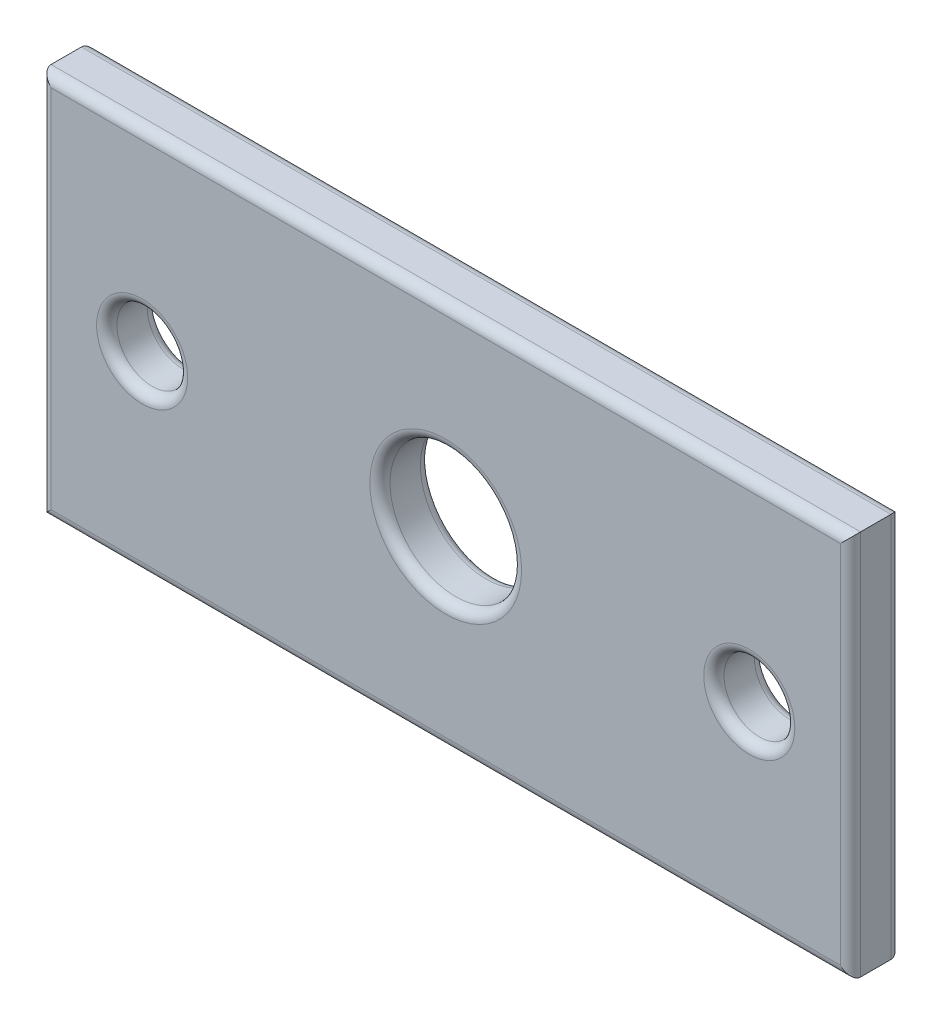
from build123d import *

# Parameters (mm, degrees)
SKETCH2_W           = 80
SKETCH2_H           = 38.1
SKETCH2_R           = 5
SKETCH2_R_2         = 10.5
SKETCH2_R_3         = 6.5
SKETCH2_R_4         = 3.5
BOSS_EXTRUDE1_DEPTH = 5
FILLET1_R           = 1


with BuildPart() as part:
    # Sketch2 → Boss-Extrude1 (new body)
    # profile 1 of 4: a face of its own
    with BuildSketch(Plane.XY):
        with Locations((40, -19.05)):
            Rectangle(SKETCH2_W, SKETCH2_H)
        with Locations((70, -19.05)):
            Circle(SKETCH2_R, mode=Mode.SUBTRACT)
        with Locations((10, -19.05)):
            Circle(SKETCH2_R, mode=Mode.SUBTRACT)
        with Locations((40, -19.05)):
            Circle(SKETCH2_R_2, mode=Mode.SUBTRACT)
    # profile 2 of 4: a face of its own
    with BuildSketch(Plane.XY):
        with Locations((40, -19.05)):
            Circle(SKETCH2_R_2)
        with Locations((40, -19.05)):
            Circle(SKETCH2_R_3, mode=Mode.SUBTRACT)
    # profile 3 of 4: a face of its own
    with BuildSketch(Plane.XY):
        with Locations((10, -19.05)):
            Circle(SKETCH2_R)
        with Locations((10, -19.05)):
            Circle(SKETCH2_R_4, mode=Mode.SUBTRACT)
    # profile 4 of 4: a face of its own
    with BuildSketch(Plane.XY):
        with Locations((70, -19.05)):
            Circle(SKETCH2_R)
        with Locations((70, -19.05)):
            Circle(SKETCH2_R_4, mode=Mode.SUBTRACT)
    extrude(amount=BOSS_EXTRUDE1_DEPTH)

    # Fillet1
    fillet1_edges = [part.edges().sort_by_distance(p)[0] for p in [
        (33.5, -19.05, 0),
        (40, -38.1, 0),
        (0, -19.05, 0),
        (40, 0, 0),
        (80, -19.05, 0),
        (40, 0, 5),
        (0, -19.05, 5),
        (40, -38.1, 5),
        (33.5, -19.05, 5),
        (6.5, -19.05, 5),
        (66.5, -19.05, 5),
        (80, -19.05, 5),
        (66.5, -19.05, 0),
        (6.5, -19.05, 0),
    ]]
    fillet(fillet1_edges, radius=FILLET1_R)


solid = part.part
